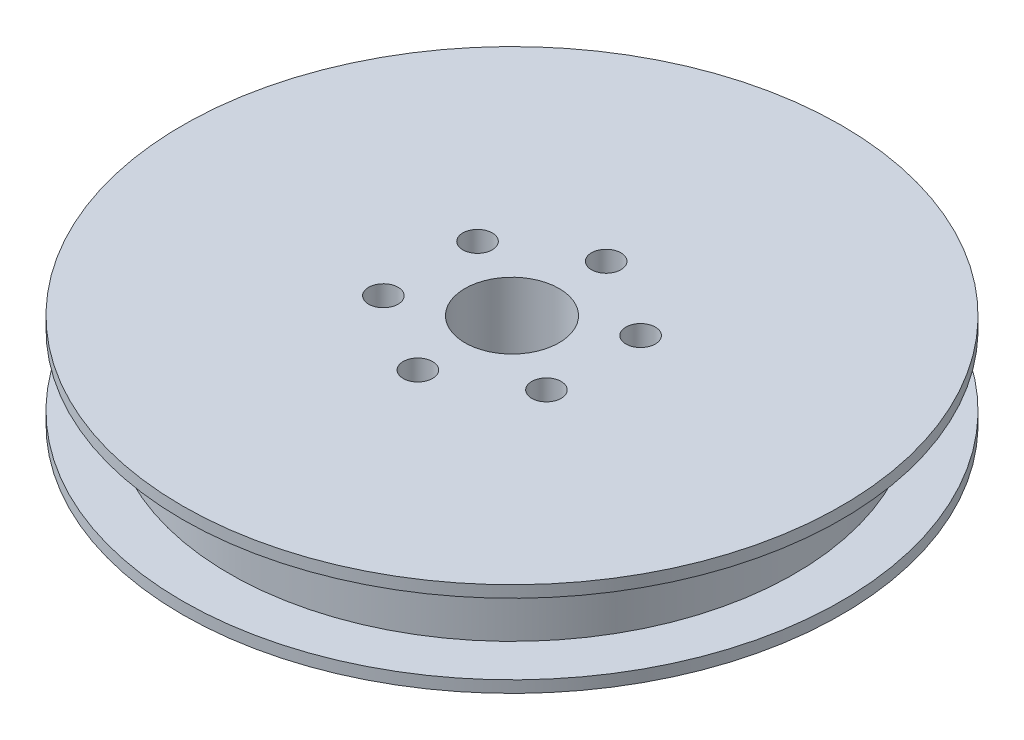
from build123d import *

# Parameters (mm, degrees)
SKETCH2_R           = 76.2
SKETCH2_R_2         = 3.96875
SKETCH2_R_3         = 12.7
BOSS_EXTRUDE1_DEPTH = 19.05
SKETCH3_R           = 88.9
SKETCH3_R_2         = 3.96875
SKETCH3_R_3         = 12.7
BOSS_EXTRUDE2_DEPTH = 3.175
BOSS_EXTRUDE3_START = 3.175
SKETCH4_R           = 88.9
SKETCH4_R_2         = 12.7
SKETCH4_R_3         = 3.96875
BOSS_EXTRUDE3_DEPTH = 3.175


with BuildPart() as part:
    # Sketch2 → Boss-Extrude1 (new body)
    with BuildSketch(Plane(origin=(0, 0, 0), x_dir=(1, 0, 0), z_dir=(0, 1, 0))):
        with Locations(Location((0, 0, 0), (0, 0, 90))):
            Circle(SKETCH2_R)
        with Locations(Location((0, 25.4, 0), (0, 0, 90))):
            Circle(SKETCH2_R_2, mode=Mode.SUBTRACT)
        with Locations(Location((21.997045256, 12.7, 0), (0, 0, 90))):
            Circle(SKETCH2_R_2, mode=Mode.SUBTRACT)
        with Locations(Location((21.997045256, -12.7, 0), (0, 0, 90))):
            Circle(SKETCH2_R_2, mode=Mode.SUBTRACT)
        with Locations(Location((0, -25.4, 0), (0, 0, 90))):
            Circle(SKETCH2_R_2, mode=Mode.SUBTRACT)
        with Locations(Location((-21.997045256, -12.7, 0), (0, 0, 90))):
            Circle(SKETCH2_R_2, mode=Mode.SUBTRACT)
        with Locations(Location((-21.997045256, 12.7, 0), (0, 0, 90))):
            Circle(SKETCH2_R_2, mode=Mode.SUBTRACT)
        with Locations(Location((0, 0, 0), (0, 0, 90))):
            Circle(SKETCH2_R_3, mode=Mode.SUBTRACT)
    extrude(amount=BOSS_EXTRUDE1_DEPTH)

    # Sketch3 → Boss-Extrude2 (add)
    with BuildSketch(Plane(origin=(0, 19.05, 0), x_dir=(1, 0, 0), z_dir=(0, 1, 0))):
        with Locations(Location((0, 0, 0), (0, 0, 270))):
            Circle(SKETCH3_R)
        with Locations(Location((0, 25.4, 0), (0, 0, 90))):
            Circle(SKETCH3_R_2, mode=Mode.SUBTRACT)
        with Locations(Location((21.997045256, 12.7, 0), (0, 0, 90))):
            Circle(SKETCH3_R_2, mode=Mode.SUBTRACT)
        with Locations(Location((21.997045256, -12.7, 0), (0, 0, 90))):
            Circle(SKETCH3_R_2, mode=Mode.SUBTRACT)
        with Locations(Location((0, -25.4, 0), (0, 0, 90))):
            Circle(SKETCH3_R_2, mode=Mode.SUBTRACT)
        with Locations(Location((-21.997045256, -12.7, 0), (0, 0, 90))):
            Circle(SKETCH3_R_2, mode=Mode.SUBTRACT)
        with Locations(Location((0, 0, 0), (0, 0, 90))):
            Circle(SKETCH3_R_3, mode=Mode.SUBTRACT)
        with Locations(Location((-21.997045256, 12.7, 0), (0, 0, 90))):
            Circle(SKETCH3_R_2, mode=Mode.SUBTRACT)
    extrude(amount=BOSS_EXTRUDE2_DEPTH)

    # Sketch4 → Boss-Extrude3 (add)
    with BuildSketch(Plane.XZ.offset(BOSS_EXTRUDE3_START)):
        with Locations(Location((0, 0, 0), (0, 0, 90))):
            Circle(SKETCH4_R)
        with Locations(Location((0, 0, 0), (0, 0, 270))):
            Circle(SKETCH4_R_2, mode=Mode.SUBTRACT)
        with Locations(Location((-21.997045256, -12.7, 0), (0, 0, 270))):
            Circle(SKETCH4_R_3, mode=Mode.SUBTRACT)
        with Locations(Location((0, -25.4, 0), (0, 0, 270))):
            Circle(SKETCH4_R_3, mode=Mode.SUBTRACT)
        with Locations(Location((21.997045256, -12.7, 0), (0, 0, 270))):
            Circle(SKETCH4_R_3, mode=Mode.SUBTRACT)
        with Locations(Location((21.997045256, 12.7, 0), (0, 0, 270))):
            Circle(SKETCH4_R_3, mode=Mode.SUBTRACT)
        with Locations(Location((0, 25.4, 0), (0, 0, 270))):
            Circle(SKETCH4_R_3, mode=Mode.SUBTRACT)
        with Locations(Location((-21.997045256, 12.7, 0), (0, 0, 270))):
            Circle(SKETCH4_R_3, mode=Mode.SUBTRACT)
    extrude(amount=-BOSS_EXTRUDE3_DEPTH)


solid = part.part
